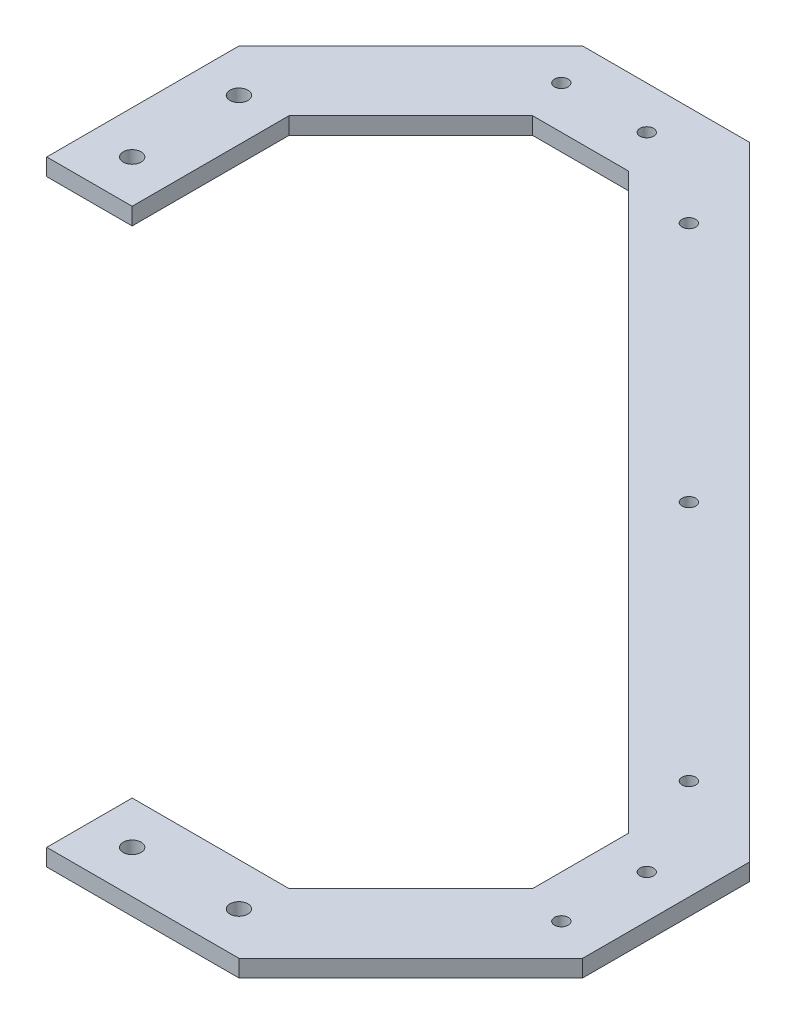
from build123d import *

# Parameters (mm, degrees)
SKETCH_1_R          = 2.1
EXTRUDE_1_DEPTH     = 4
SKETCH_2_R          = 1.6
CUT_EXTRUDE_1_DEPTH = 50


with BuildPart() as part:
    # 草图1 → 凸台-拉伸1 (new body)
    with BuildSketch(Plane(origin=(0, 0, 0), x_dir=(1, 0, 0), z_dir=(0, 1, 0))):
        Polygon((20, 0), (0, 0), (0, 45), (40.25, 85.25), (79.25, 85.25), (225.25, -60.75), (225.25, -99.75), (185, -140), (140, -140), (140, -120), (176.715728753, -120), (205.25, -91.465728753), (205.25, -69.034271247), (70.965728753, 65.25), (48.534271247, 65.25), (20, 36.715728753), align=None)
        with Locations(Location((10, 10, 0), (0, 0, 270))):
            Circle(SKETCH_1_R, mode=Mode.SUBTRACT)
        with Locations(Location((10, 35, 0), (0, 0, 90))):
            Circle(SKETCH_1_R, mode=Mode.SUBTRACT)
        with Locations(Location((175, -130, 0), (0, 0, 270))):
            Circle(SKETCH_1_R, mode=Mode.SUBTRACT)
        with Locations(Location((150, -130, 0), (0, 0, 90))):
            Circle(SKETCH_1_R, mode=Mode.SUBTRACT)
    extrude(amount=EXTRUDE_1_DEPTH)

    # 草图2 → 切除-拉伸1 (cut)
    with BuildSketch(Plane(origin=(0, 4, 0), x_dir=(1, 0, 0), z_dir=(0, 1, 0))):
        with Locations(Location((215.25, -94.75, 0), (0, 0, 270))):
            Circle(SKETCH_2_R)
        with Locations(Location((215.25, -74.75, 0), (0, 0, 270))):
            Circle(SKETCH_2_R)
        with Locations(Location((201.747474683, -51.389610307, 0), (0, 0, 270))):
            Circle(SKETCH_2_R)
        with Locations(Location((145.178932188, 5.178932188, 0), (0, 0, 270))):
            Circle(SKETCH_2_R)
        with Locations(Location((88.610389693, 61.747474683, 0), (0, 0, 90))):
            Circle(SKETCH_2_R)
        with Locations(Location((65.25, 75.25, 0), (0, 0, 90))):
            Circle(SKETCH_2_R)
        with Locations(Location((45.25, 75.25, 0), (0, 0, 90))):
            Circle(SKETCH_2_R)
    extrude(amount=-CUT_EXTRUDE_1_DEPTH, mode=Mode.SUBTRACT)


solid = part.part
